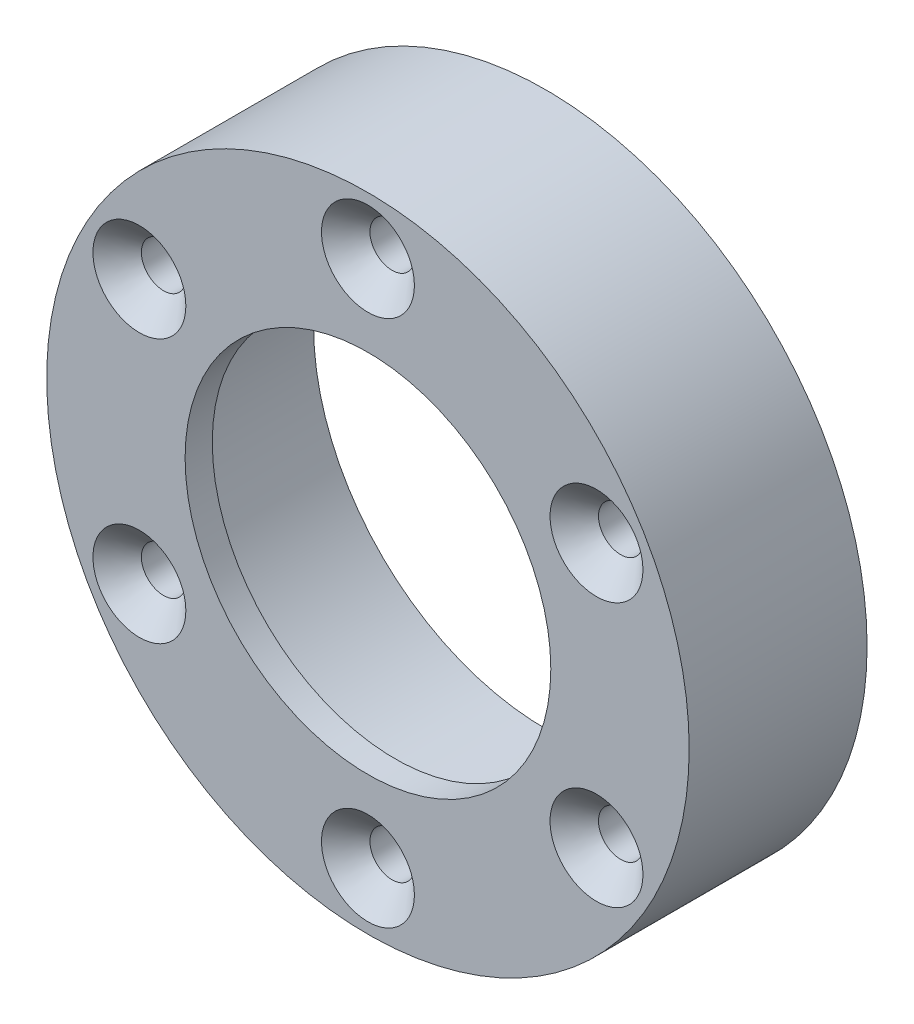
from build123d import *

# Parameters (mm, degrees)
SKETCH1_R                                       = 32.5
BOSS_EXTRUDE1_DEPTH                             = 18
CSK_FOR_M4_FLAT_HEAD_MACHINE_SCREW1_D           = 4.5
CSK_FOR_M4_FLAT_HEAD_MACHINE_SCREW1_CSINK_D     = 9.4
CSK_FOR_M4_FLAT_HEAD_MACHINE_SCREW1_CSINK_ANGLE = 90
CIRPATTERN1_COUNT                               = 6
SKETCH4_R                                       = 18.5
CUT_EXTRUDE1_DEPTH                              = 30
SKETCH5_R                                       = 23.5
CUT_EXTRUDE2_DEPTH                              = 15.25


with BuildPart() as part:
    # Sketch1 → Boss-Extrude1 (new body)
    with BuildSketch(Plane.XY):
        Circle(SKETCH1_R)
    extrude(amount=BOSS_EXTRUDE1_DEPTH)

    # CSK for M4 Flat Head Machine Screw1 (through all)
    with Locations(Plane.XY.offset(18)):
        with Locations((0, 26.7)):
            csk_for_m4_flat_head_machine_screw1 = CounterSinkHole(CSK_FOR_M4_FLAT_HEAD_MACHINE_SCREW1_D / 2, CSK_FOR_M4_FLAT_HEAD_MACHINE_SCREW1_CSINK_D / 2, counter_sink_angle=CSK_FOR_M4_FLAT_HEAD_MACHINE_SCREW1_CSINK_ANGLE)

    # CirPattern1: CSK for M4 Flat Head Machine Screw1 ×6 about axis
    cirpattern1_axis = Axis((0, 0, 0), (0, 0, 1))
    for i in range(1, CIRPATTERN1_COUNT):
        add(csk_for_m4_flat_head_machine_screw1.rotate(cirpattern1_axis, i * 360 / CIRPATTERN1_COUNT), mode=Mode.SUBTRACT)

    # Sketch4 → Cut-Extrude1 (cut)
    with BuildSketch(Plane(origin=(0, 0, 0), x_dir=(-1, 0, 0), z_dir=(0, 0, -1))):
        Circle(SKETCH4_R)
    extrude(amount=-CUT_EXTRUDE1_DEPTH, mode=Mode.SUBTRACT)

    # Sketch5 → Cut-Extrude2 (cut)
    with BuildSketch(Plane(origin=(0, 0, 0), x_dir=(-1, 0, 0), z_dir=(0, 0, -1))):
        Circle(SKETCH5_R)
    extrude(amount=-CUT_EXTRUDE2_DEPTH, mode=Mode.SUBTRACT)


solid = part.part
